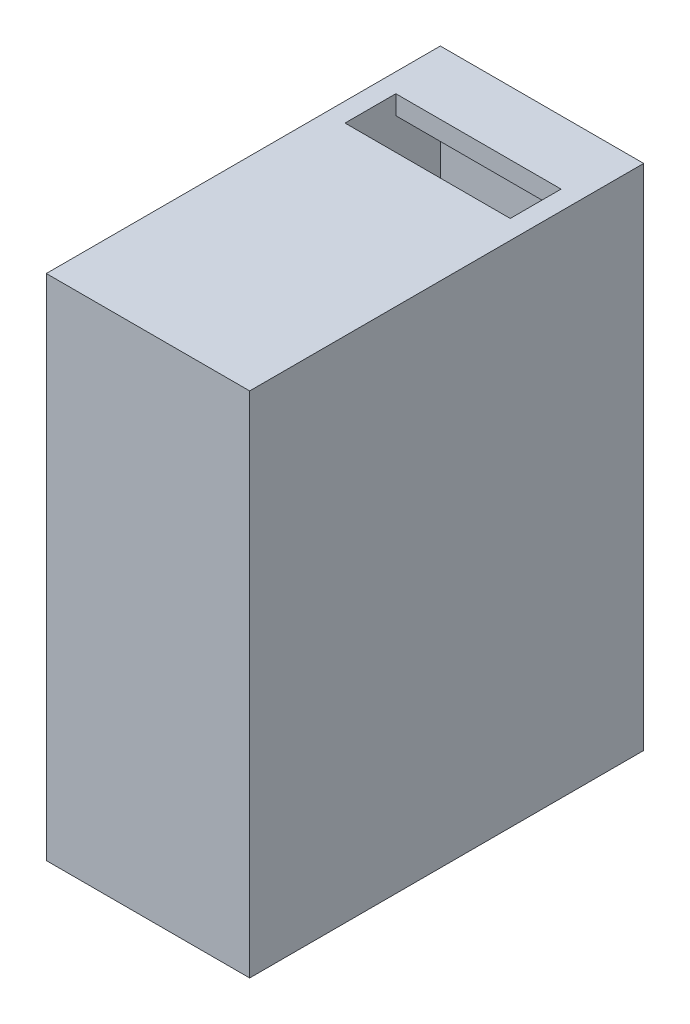
from build123d import *

# Parameters (mm, degrees)
SKETCH1_W           = 16
SKETCH1_H           = 31
BOSS_EXTRUDE1_DEPTH = 40
SHELL1_T            = -1.5
SKETCH2_W           = 13
SKETCH2_H           = 4
CUT_EXTRUDE1_DEPTH  = 1.5
SKETCH3_W           = 13.5
SKETCH3_H           = 21
CUT_EXTRUDE2_DEPTH  = 1.5


with BuildPart() as part:
    # Sketch1 → Boss-Extrude1 (new body)
    with BuildSketch(Plane(origin=(0, 0, 0), x_dir=(1, 0, 0), z_dir=(0, 1, 0))):
        with Locations((8, -15.5)):
            Rectangle(SKETCH1_W, SKETCH1_H)
    extrude(amount=BOSS_EXTRUDE1_DEPTH)

    # Shell1
    shell1_openings = [part.faces().sort_by_distance(p)[0] for p in [
        (8, 0, 15.5),
    ]]
    offset(amount=SHELL1_T, openings=shell1_openings, kind=Kind.INTERSECTION)

    # Sketch2 → Cut-Extrude1 (cut)
    with BuildSketch(Plane(origin=(0, 40, 0), x_dir=(1, 0, 0), z_dir=(0, 1, 0))):
        with Locations((8, -7)):
            Rectangle(SKETCH2_W, SKETCH2_H)
    extrude(amount=-CUT_EXTRUDE1_DEPTH, mode=Mode.SUBTRACT)

    # Sketch3 → Cut-Extrude2 (cut)
    with BuildSketch(Plane(origin=(0, 0, 0), x_dir=(-1, 0, 0), z_dir=(0, 0, -1))):
        with Locations((-8.031141197, 9.5)):
            Rectangle(SKETCH3_W, SKETCH3_H)
    extrude(amount=-CUT_EXTRUDE2_DEPTH, mode=Mode.SUBTRACT)


solid = part.part
